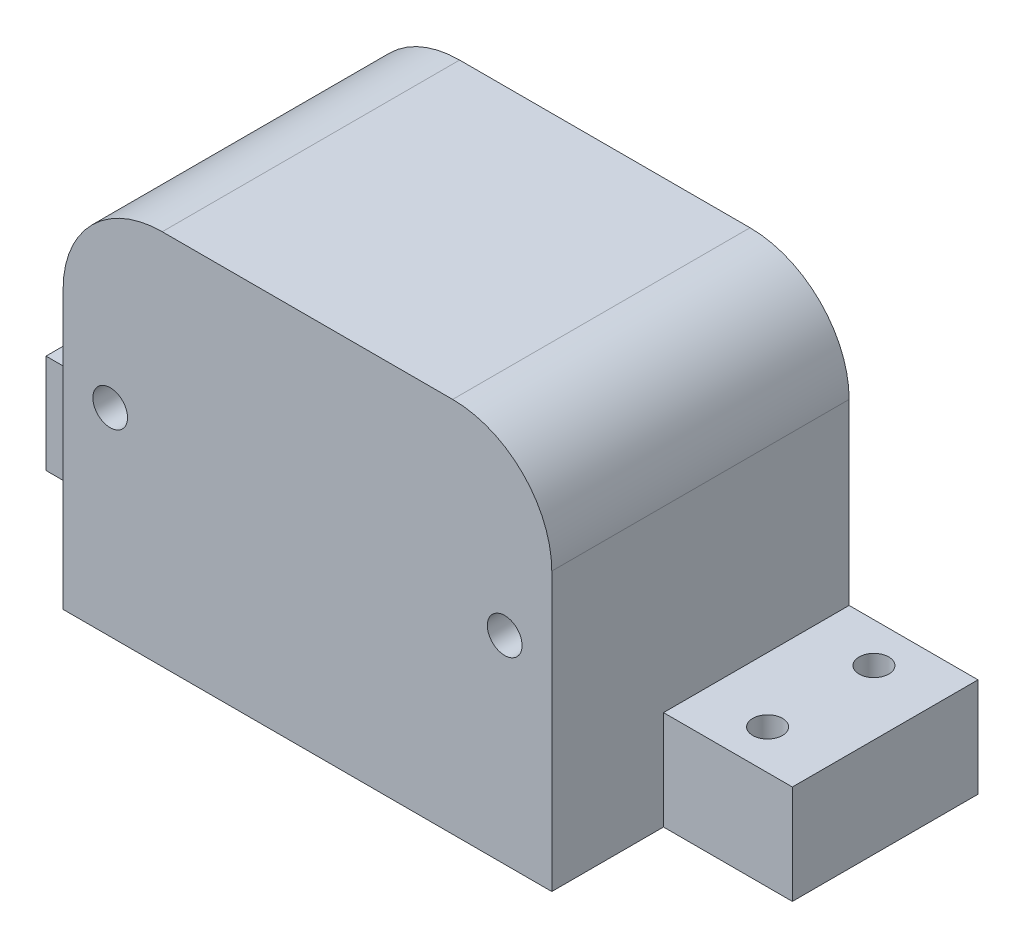
from build123d import *

# Parameters (mm, degrees)
SKETCH_2_W          = 49.3
SKETCH_2_H          = 38
SKETCH_2_R          = 1.75
SKETCH_2_W_2        = 13
SKETCH_2_H_2        = 10
EXTRUDE_1_DEPTH     = 30
FILLET_2_R          = 10
SKETCH_5_R          = 1.5
SKETCH_5_W          = 13
SKETCH_5_H          = 11.272014512
CUT_EXTRUDE_2_DEPTH = 20


with BuildPart() as part:
    # Эскиз2 → Бобышка-Вытянуть1 (new body)
    # profile 1 of 3: a face of its own
    with BuildSketch(Plane.XY):
        Rectangle(SKETCH_2_W, SKETCH_2_H)
        with Locations((-19.9, 1)):
            Circle(SKETCH_2_R, mode=Mode.SUBTRACT)
        with Locations((19.9, 1)):
            Circle(SKETCH_2_R, mode=Mode.SUBTRACT)
    # profile 2 of 3: a face of its own
    with BuildSketch(Plane.XY):
        with Locations((-31.15, -14)):
            Rectangle(SKETCH_2_W_2, SKETCH_2_H_2)
    # profile 3 of 3: a face of its own
    with BuildSketch(Plane.XY):
        with Locations((31.15, -14)):
            Rectangle(SKETCH_2_W_2, SKETCH_2_H_2)
    extrude(amount=EXTRUDE_1_DEPTH)

    # Скругление2
    fillet_2_edges = [part.edges().sort_by_distance(p)[0] for p in [
        (-24.65, 19, 15),
        (24.65, 19, 15),
    ]]
    fillet(fillet_2_edges, radius=FILLET_2_R)

    # Эскиз5 → Вырез-Вытянуть2 (cut)
    with BuildSketch(Plane(origin=(0, -9, 0), x_dir=(1, 0, 0), z_dir=(0, 1, 0))):
        with Locations(Location((-31.15, -4, 0), (0, 0, 180))):
            Circle(SKETCH_5_R)
        with Locations(Location((-31.15, -14.727985488, 0), (0, 0, 180))):
            Circle(SKETCH_5_R)
        with Locations(Location((31.15, -14.727985488, 0), (0, 0, 270))):
            Circle(SKETCH_5_R)
        with Locations(Location((31.15, -4, 0), (0, 0, 270))):
            Circle(SKETCH_5_R)
        with Locations((-31.15, -24.363992744)):
            Rectangle(SKETCH_5_W, SKETCH_5_H)
        with Locations((31.15, -24.363992744)):
            Rectangle(SKETCH_5_W, SKETCH_5_H)
    extrude(amount=-CUT_EXTRUDE_2_DEPTH, mode=Mode.SUBTRACT)


solid = part.part
